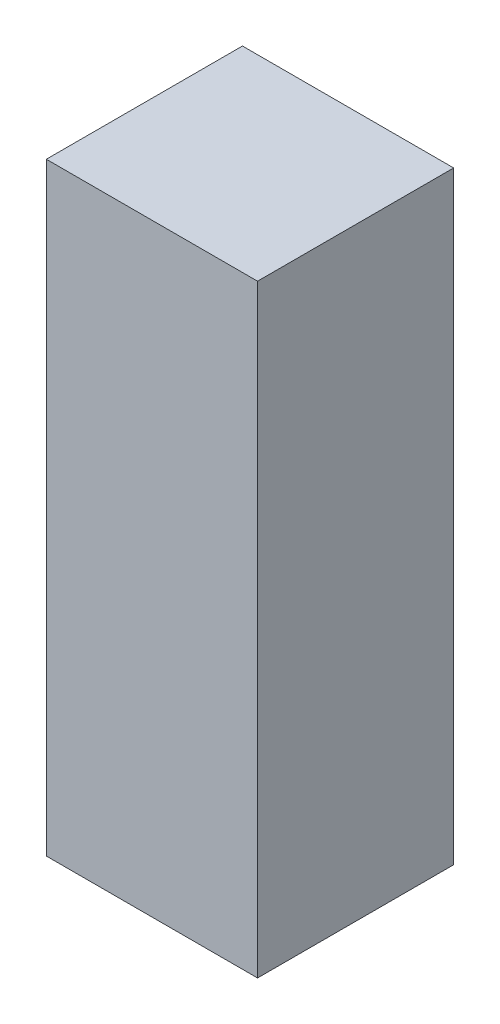
from build123d import *

# Parameters (mm, degrees)
PACK_PANO_KAPAGI_MENTESE_1_1_START = 20
SKETCH1_W                          = 14
SKETCH1_H                          = 40
PACK_PANO_KAPAGI_MENTESE_1_1_DEPTH = 13


with BuildPart() as part:
    # Sketch1 → PACK_pano_kapagi_mentese_1_1 (new body)
    with BuildSketch(Plane.XY.offset(PACK_PANO_KAPAGI_MENTESE_1_1_START)):
        with Locations((31, 180)):
            Rectangle(SKETCH1_W, SKETCH1_H)
    extrude(amount=PACK_PANO_KAPAGI_MENTESE_1_1_DEPTH)


solid = part.part
